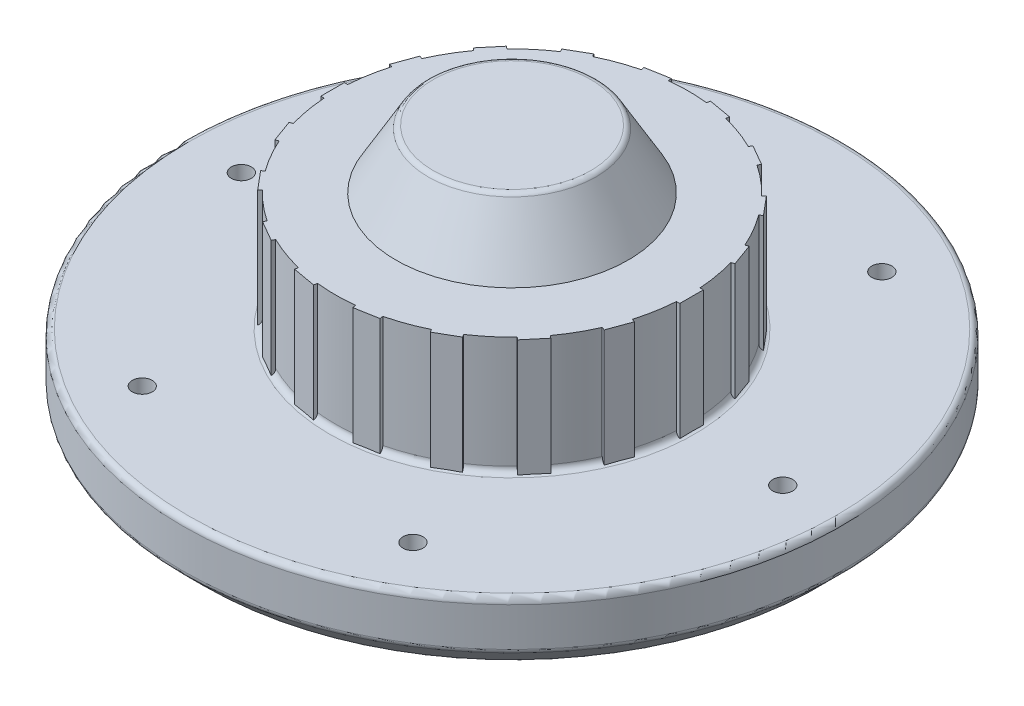
from build123d import *

# Parameters (mm, degrees)
SOCKET_HOLE_D             = 3.4
SOCKET_HOLE_CBORE_D       = 6.5
SOCKET_HOLE_CBORE_DEPTH   = 8
SOCKET_HOLE_PATTERN_COUNT = 6
OVERALL_FILLETS_R         = 1
SIDE_EXTRUSION_REACH      = 87.417
SKETCH6_W                 = 1
SKETCH6_H                 = 4
CIRPATTERN1_COUNT         = 18


with BuildPart() as part:
    # Sketch1 → body (revolve)
    with BuildSketch(Plane.XY, mode=Mode.PRIVATE) as body_sk:
        Polygon((0, 42), (13.976497308, 42), (19.75, 32), (30, 32), (30, 12), (56, 12), (56, 4), (52, 0), (0, 0), align=None)
    revolve(body_sk.sketch.rotate(Axis((0, 0, 0), (0, 1, 0)), 90), axis=Axis((0, 0, 0), (0, 1, 0)))

    # socket_hole (through all)
    with Locations(Plane.XZ):
        with Locations((46, 0)):
            socket_hole = CounterBoreHole(SOCKET_HOLE_D / 2, SOCKET_HOLE_CBORE_D / 2, SOCKET_HOLE_CBORE_DEPTH)

    # socket_hole_pattern: socket_hole ×6 about axis
    socket_hole_pattern_axis = Axis((0, 0, 0), (0, 1, 0))
    for i in range(1, SOCKET_HOLE_PATTERN_COUNT):
        add(socket_hole.rotate(socket_hole_pattern_axis, i * 360 / SOCKET_HOLE_PATTERN_COUNT), mode=Mode.SUBTRACT)

    # overall_fillets
    overall_fillets_edges = [part.edges().sort_by_distance(p)[0] for p in [
        (0, 42, 13.976497308),
        (42.75, 0, 0),
        (21.375, 0, 37.022586012),
        (-21.375, 0, 37.022586012),
        (-42.75, 0, 0),
        (-21.375, 0, -37.022586012),
        (21.375, 0, -37.022586012),
        (0, 0, 52),
        (0, 4, 56),
        (0, 12, 56),
        (0, 12, 30),
    ]]
    fillet(overall_fillets_edges, radius=OVERALL_FILLETS_R)

    # Sketch6 → side_extrusion (add, up to next)
    with BuildSketch(Plane(origin=(0, 32, 0), x_dir=(1, 0, 0), z_dir=(0, 1, 0)), mode=Mode.PRIVATE) as side_extrusion_sk1:
        with Locations((30, 0)):
            Rectangle(SKETCH6_W, SKETCH6_H)
    side_extrusion_tool1 = extrude(side_extrusion_sk1.sketch, amount=-SIDE_EXTRUSION_REACH, mode=Mode.PRIVATE) - part.part
    side_extrusion = side_extrusion_tool1.solids().sort_by_distance((30, 32, 0))[0]
    add(side_extrusion)

    # CirPattern1: side_extrusion ×18 about axis
    cirpattern1_axis = Axis((0, 0, 0), (0, 1, 0))
    for i in range(1, CIRPATTERN1_COUNT):
        add(side_extrusion.rotate(cirpattern1_axis, i * 360 / CIRPATTERN1_COUNT))


solid = part.part
